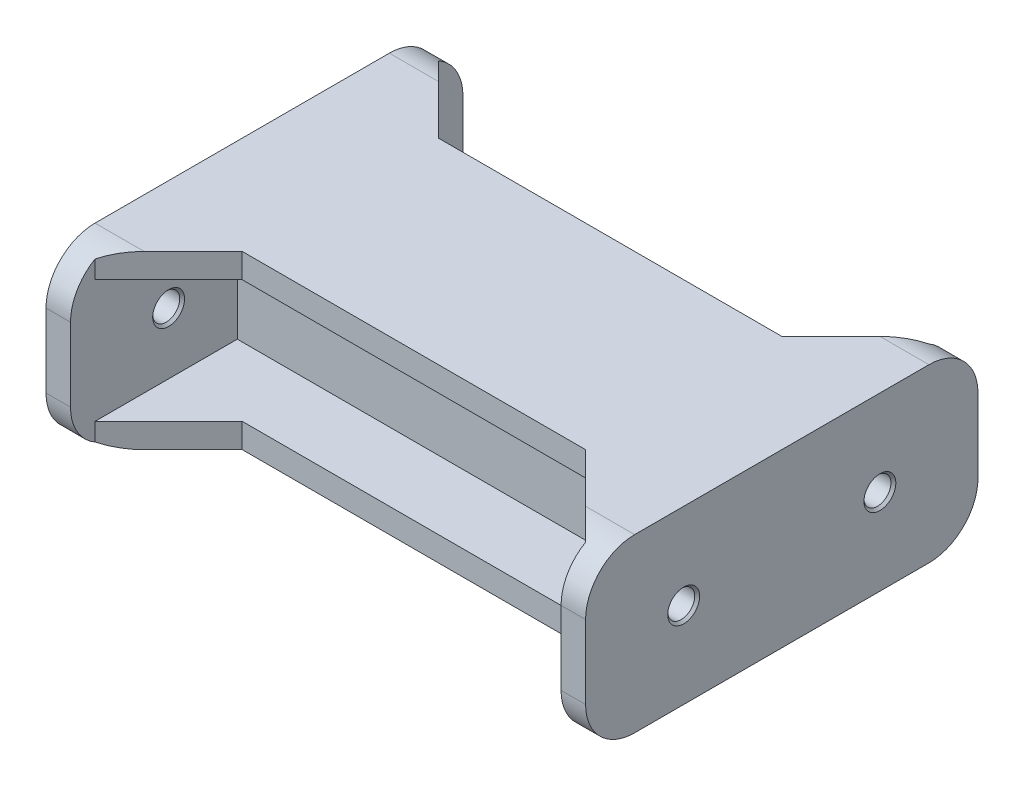
from build123d import *

# Parameters (mm, degrees)
SKETCH_1_W          = 80
SKETCH_1_H          = 20
EXTRUDE_1_DEPTH     = 5
EXTRUDE_3_DEPTH     = 100
SKETCH_5_W          = 12
SKETCH_5_H          = 15
EXTRUDE_4_DEPTH     = 105
SKETCH_6_W          = 34
SKETCH_6_H          = 15
EXTRUDE_5_DEPTH     = 5
SKETCH_7_W          = 80
SKETCH_7_H          = 35
EXTRUDE_6_DEPTH     = 5
EXTRUDE_7_DEPTH     = 5
SKETCH_9_R          = 2.75
CUT_EXTRUDE_1_DEPTH = 119.74342087
CHAMFER_1_SIZE      = 0.5
FILLET_1_R          = 10
EXTRUDE_8_DEPTH     = 5
FILLET_2_R          = 10


with BuildPart() as part:
    # 草图1 → 凸台-拉伸1 (new body)
    with BuildSketch(Plane(origin=(0, 0, 0), x_dir=(0, 0, -1), z_dir=(1, 0, 0))):
        with Locations((0, -5)):
            Rectangle(SKETCH_1_W, SKETCH_1_H)
    extrude(amount=EXTRUDE_1_DEPTH)

    # 草图3 → 凸台-拉伸3 (add)
    with BuildSketch(Plane(origin=(5, 0, 0), x_dir=(0, 0, -1), z_dir=(1, 0, 0))):
        Polygon((-6, 5), (6, 5), (6, -10), (20, -10), (20, -15), (-20, -15), (-20, -10), (-6, -10), align=None)
    extrude(amount=EXTRUDE_3_DEPTH)

    # 草图5 → 凸台-拉伸4 (add)
    with BuildSketch(Plane.ZY):
        with Locations((0, 12.5)):
            Rectangle(SKETCH_5_W, SKETCH_5_H)
    extrude(amount=-EXTRUDE_4_DEPTH)

    # 草图6 → 凸台-拉伸5 (add)
    with BuildSketch(Plane.ZY):
        with Locations((23, 12.5)):
            Rectangle(SKETCH_6_W, SKETCH_6_H)
        with Locations((-23, 12.5)):
            Rectangle(SKETCH_6_W, SKETCH_6_H)
    extrude(amount=-EXTRUDE_5_DEPTH)

    # 草图7 → 凸台-拉伸6 (add)
    with BuildSketch(Plane(origin=(105, 0, 0), x_dir=(0, 0, -1), z_dir=(1, 0, 0))):
        with Locations((0, 2.5)):
            Rectangle(SKETCH_7_W, SKETCH_7_H)
    extrude(amount=EXTRUDE_6_DEPTH)

    # 草图8 → 凸台-拉伸7 (add)
    with BuildSketch(Plane.XZ.offset(15)):
        Polygon((90, 20), (105, 35), (105, 20), align=None)
        Polygon((105, -20), (90, -20), (105, -35), align=None)
        Polygon((5, 20), (20, 20), (5, 35), align=None)
        Polygon((20, -20), (5, -35), (5, -20), align=None)
    extrude(amount=-EXTRUDE_7_DEPTH)

    # 草图9 → 切除-拉伸1 (cut, through all)
    with BuildSketch(Plane(origin=(110, 0, 0), x_dir=(0, 0, -1), z_dir=(1, 0, 0))):
        with Locations((20, 2.5)):
            Circle(SKETCH_9_R)
        with Locations(Location((-20, 2.5, 0), (0, 0, 180))):
            Circle(SKETCH_9_R)
    extrude(amount=-CUT_EXTRUDE_1_DEPTH, mode=Mode.SUBTRACT)

    # 倒角1
    chamfer_1_edges = [part.edges().sort_by_distance(p)[0] for p in [
        (105, 2.5, -17.25),
        (5, 2.5, -17.25),
        (0, 2.5, -17.25),
        (110, 2.5, -17.25),
        (105, 2.5, 17.25),
        (5, 2.5, 17.25),
        (0, 2.5, 17.25),
        (110, 2.5, 17.25),
    ]]
    chamfer(chamfer_1_edges, length=CHAMFER_1_SIZE)

    # 圆角1
    fillet_1_edges = [part.edges().sort_by_distance(p)[0] for p in [
        (107.5, -15, -40),
        (107.5, -15, 40),
        (2.5, -15, 40),
        (2.5, -15, -40),
    ]]
    fillet(fillet_1_edges, radius=FILLET_1_R)

    # 草图10 → 凸台-拉伸8 (add)
    with BuildSketch(Plane(origin=(0, 20, 0), x_dir=(1, 0, 0), z_dir=(0, 1, 0))):
        Polygon((5, 35), (5, 6), (105, 6), (105, 35), (90, 20), (20, 20), align=None)
        Polygon((5, -6), (5, -35), (20, -20), (90, -20), (105, -35), (105, -6), align=None)
    extrude(amount=-EXTRUDE_8_DEPTH)

    # 圆角2
    fillet_2_edges = [part.edges().sort_by_distance(p)[0] for p in [
        (107.5, 20, 40),
        (107.5, 20, -40),
        (2.5, 20, 40),
        (2.5, 20, -40),
    ]]
    fillet(fillet_2_edges, radius=FILLET_2_R)


solid = part.part
